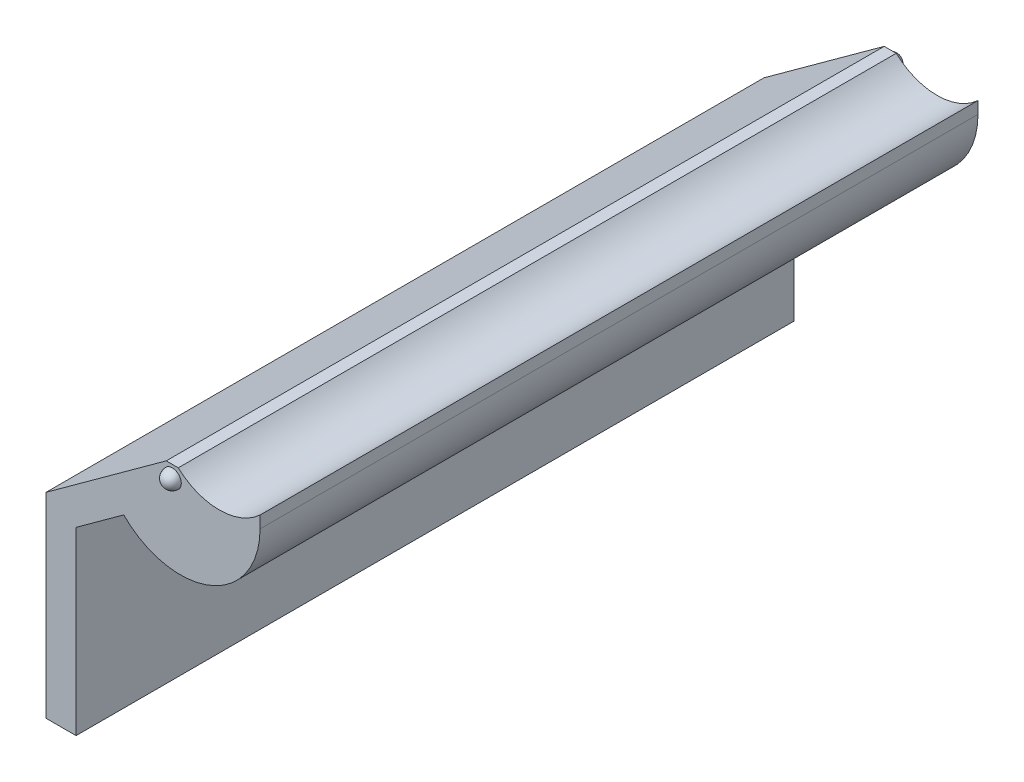
from build123d import *

# Parameters (mm, degrees)
BOSS_EXTRUDE1_DEPTH = 75.819


with BuildPart() as part:
    # Sketch1 → Boss-Extrude1 (new, symmetric)
    with BuildSketch(Plane.XY):
        with BuildLine():
            Line((-19.05, -41.467593741), (-8.981837469, -34.152645484))
            ThreePointArc((-8.981837469, -34.152645484), (9.380639725, -37.883478952), (19.812, -22.317926926))
            Line((19.812, -22.317926926), (19.812, -19.777926926))
            ThreePointArc((19.812, -19.777926926), (11.176, -23.166133114), (2.54, -19.777926926))
            Line((2.54, -19.777926926), (0, -19.777926926))
            Line((0, -19.777926926), (-25.4, -38.232107137))
            Line((-25.4, -38.232107137), (-25.4, -79.567593741))
            Line((-25.4, -79.567593741), (-19.05, -79.567593741))
            Line((-19.05, -79.567593741), (-19.05, -41.467593741))
        make_face()
    extrude(amount=BOSS_EXTRUDE1_DEPTH, both=True)

    # Sketch2 → Revolve1 (revolve)
    with BuildSketch(Plane.XY.offset(75.819)):
        with BuildLine():
            Line((1.27, -20.412926926), (1.27, -24.222926926))
            ThreePointArc((1.27, -24.222926926), (3.175, -22.317926926), (1.27, -20.412926926))
        make_face()
    revolve(axis=Axis((1.27, -20.412926926, 75.819), (0, -1, 0)))

    # Sketch3 → Revolve2 (revolve)
    with BuildSketch(Plane(origin=(0, 0, -75.819), x_dir=(-1, 0, 0), z_dir=(0, 0, -1))):
        with BuildLine():
            Line((-1.27, -20.412926926), (-1.27, -24.222926926))
            ThreePointArc((-1.27, -24.222926926), (0.635, -22.317926926), (-1.27, -20.412926926))
        make_face()
    revolve(axis=Axis((1.27, -20.412926926, -75.819), (0, -1, 0)))


solid = part.part
